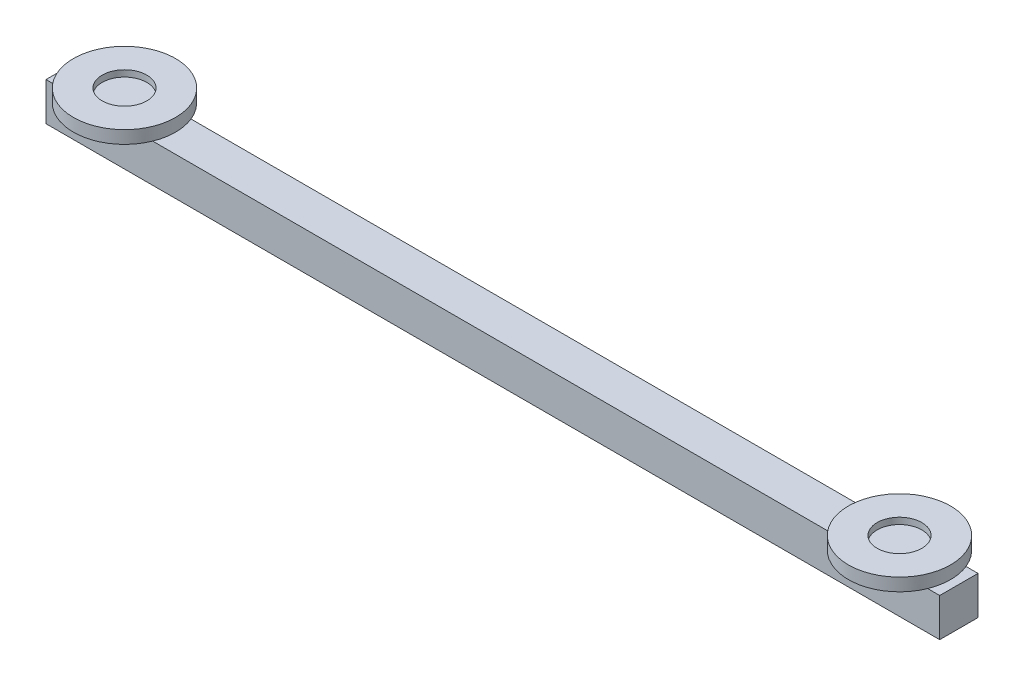
from build123d import *

# Parameters (mm, degrees)
SKETCH1_W           = 30
SKETCH1_H           = 30
BOSS_EXTRUDE1_DEPTH = 350
SKETCH2_R           = 40
BOSS_EXTRUDE2_DEPTH = 10
SKETCH3_R           = 17.5
CUT_EXTRUDE1_DEPTH  = 5


with BuildPart() as part:
    # Sketch1 → Boss-Extrude1 (new, symmetric)
    with BuildSketch(Plane(origin=(0, 0, 0), x_dir=(0, 0, -1), z_dir=(1, 0, 0))):
        Rectangle(SKETCH1_W, SKETCH1_H)
    extrude(amount=BOSS_EXTRUDE1_DEPTH, both=True)

    # Sketch2 → Boss-Extrude2 (add)
    with BuildSketch(Plane(origin=(0, 15, 0), x_dir=(1, 0, 0), z_dir=(0, 1, 0))):
        with Locations(Location((303.514520503, 0, 0), (0, 0, 157.975687163))):
            Circle(SKETCH2_R)
    boss_extrude2 = extrude(amount=BOSS_EXTRUDE2_DEPTH)

    # Sketch3 → Cut-Extrude1 (cut)
    with BuildSketch(Plane(origin=(0, 25, 0), x_dir=(1, 0, 0), z_dir=(0, 1, 0))):
        with Locations(Location((303.514520503, 0, 0), (0, 0, 270))):
            Circle(SKETCH3_R)
    cut_extrude1 = extrude(amount=-CUT_EXTRUDE1_DEPTH, mode=Mode.SUBTRACT)

    # Mirror1: Boss-Extrude2, Cut-Extrude1 across plane
    add(boss_extrude2.mirror(Plane(origin=(0, 0, 0), x_dir=(0, 0, 1), z_dir=(1, 0, 0))))
    add(cut_extrude1.mirror(Plane(origin=(0, 0, 0), x_dir=(0, 0, 1), z_dir=(1, 0, 0))), mode=Mode.SUBTRACT)


solid = part.part
